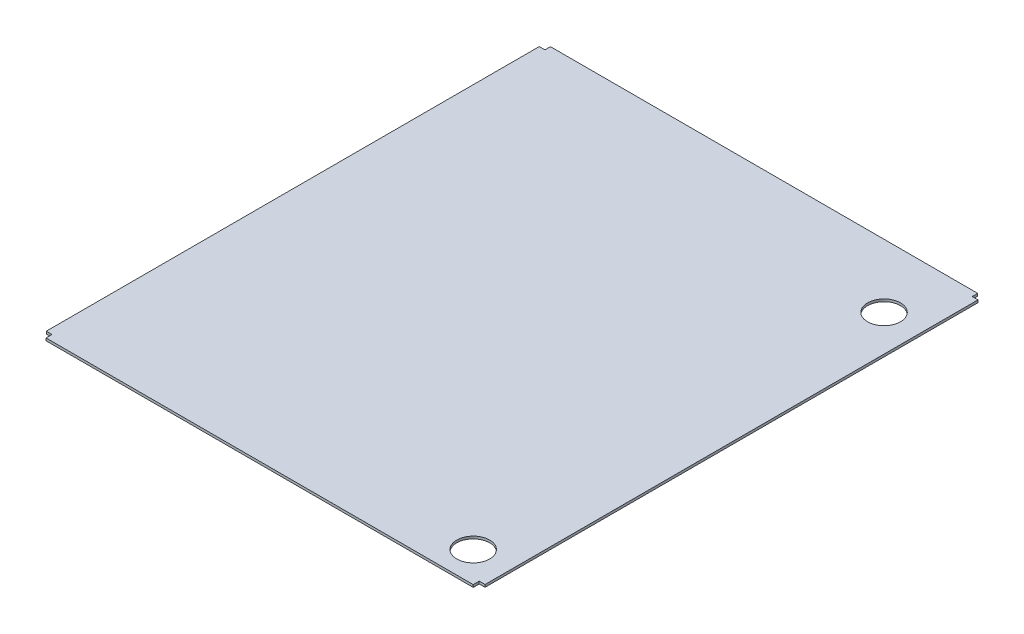
from build123d import *

# Parameters (mm, degrees)
SKETCH1_W           = 534
SKETCH1_H           = 600
BOSS_EXTRUDE1_DEPTH = 3
SKETCH3_W           = 520
SKETCH3_H           = 614
BOSS_EXTRUDE2_DEPTH = 3
SKETCH4_R           = 20
CUT_EXTRUDE5_DEPTH  = 10
SKETCH5_R           = 20
CUT_EXTRUDE7_DEPTH  = 10


with BuildPart() as part:
    # Sketch1 → Boss-Extrude1 (new body)
    with BuildSketch(Plane(origin=(0, 0, 0), x_dir=(1, 0, 0), z_dir=(0, 1, 0))):
        with Locations((267.046520854, 300.291126183)):
            Rectangle(SKETCH1_W, SKETCH1_H)
    extrude(amount=BOSS_EXTRUDE1_DEPTH)

    # Sketch3 → Boss-Extrude2 (add)
    with BuildSketch(Plane(origin=(0, 0, 0), x_dir=(1, 0, 0), z_dir=(0, 1, 0))):
        with Locations((267, 300)):
            Rectangle(SKETCH3_W, SKETCH3_H)
    extrude(amount=BOSS_EXTRUDE2_DEPTH)

    # Sketch4 → Cut-Extrude5 (cut)
    with BuildSketch(Plane(origin=(0, 3, 0), x_dir=(1, 0, 0), z_dir=(0, 1, 0))):
        with Locations(Location((490, 530, 0), (0, 0, 270))):
            Circle(SKETCH4_R)
    extrude(amount=-CUT_EXTRUDE5_DEPTH, mode=Mode.SUBTRACT)

    # Sketch5 → Cut-Extrude7 (cut)
    with BuildSketch(Plane(origin=(0, 0, 0), x_dir=(-1, 0, 0), z_dir=(0, -1, 0))):
        with Locations(Location((-490, 30, 0), (0, 0, 90))):
            Circle(SKETCH5_R)
    extrude(amount=-CUT_EXTRUDE7_DEPTH, mode=Mode.SUBTRACT)


solid = part.part
